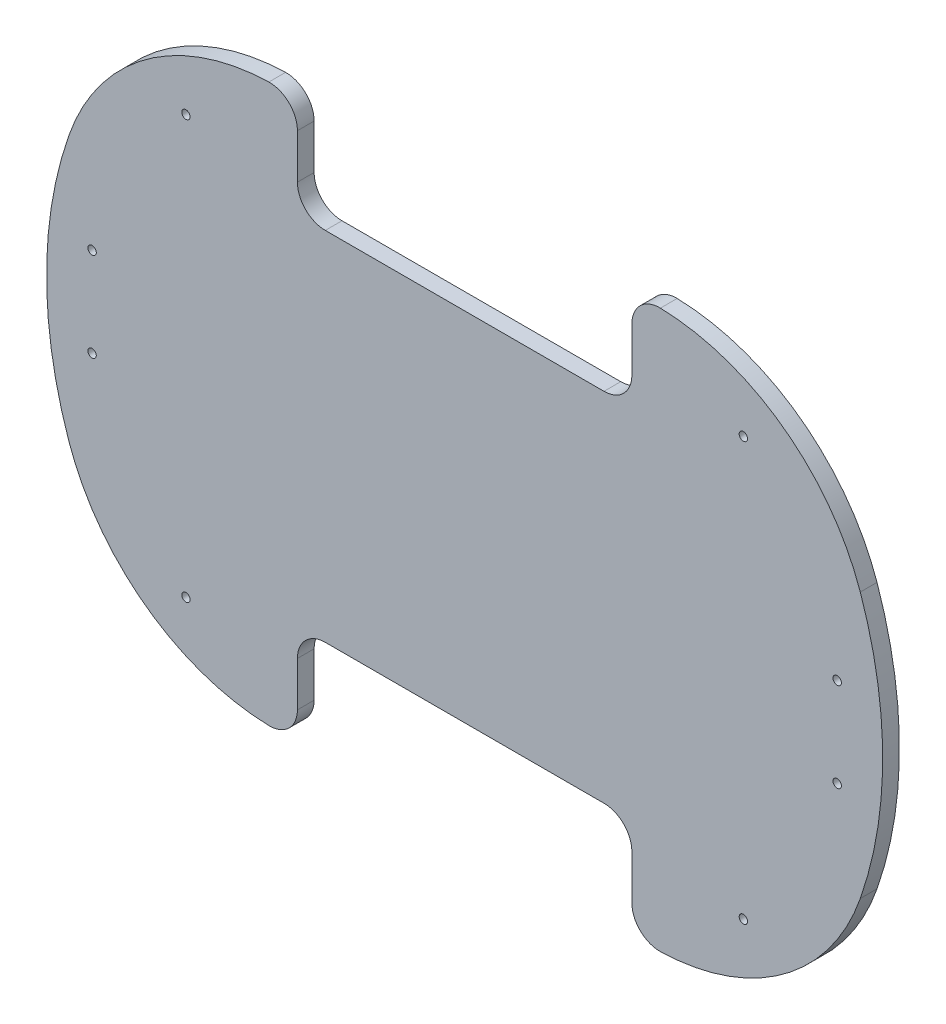
from build123d import *

# Parameters (mm, degrees)
BOSS_EXTRUDE1_DEPTH = 3
FILLET1_R           = 39
FILLET3_R           = 5
SKETCH7_R           = 0.75
CUT_EXTRUDE2_DEPTH  = 3
SKETCH8_R           = 0.75
CUT_EXTRUDE3_DEPTH  = 91.182696374


with BuildPart() as part:
    # Sketch1 → Boss-Extrude1 (new body)
    with BuildSketch(Plane.XY):
        Polygon((-30, 50), (-55, 50), (-55, -50), (-30, -50), (-30, -32), (30, -32), (30, -50), (55, -50), (55, 50), (30, 50), (30, 32), (-30, 32), align=None)
        with BuildLine():
            Line((-55, -50), (-55, 50))
            ThreePointArc((-55, 50), (-75, 0), (-55, -50))
        make_face()
        with BuildLine():
            ThreePointArc((55, -50), (75, 0), (55, 50))
            Line((55, 50), (55, -50))
        make_face()
    extrude(amount=BOSS_EXTRUDE1_DEPTH)

    # Fillet1
    fillet1_edges = [part.edges().sort_by_distance(p)[0] for p in [
        (-55, 50, 1.5),
        (55, 50, 1.5),
        (55, -50, 1.5),
        (-55, -50, 1.5),
    ]]
    fillet(fillet1_edges, radius=FILLET1_R)

    # Fillet3
    fillet3_edges = [part.edges().sort_by_distance(p)[0] for p in [
        (30, -50, 1.5),
        (-30, -50, 1.5),
        (30, 50, 1.5),
        (-30, 50, 1.5),
        (30, 32, 1.5),
        (-30, 32, 1.5),
        (-30, -32, 1.5),
        (30, -32, 1.5),
    ]]
    fillet(fillet3_edges, radius=FILLET3_R)

    # Sketch7 → Cut-Extrude2 (cut)
    with BuildSketch(Plane.XY.offset(3)):
        with Locations((-50, 37.5)):
            Circle(SKETCH7_R)
        with Locations((-50, -37.5)):
            Circle(SKETCH7_R)
        with Locations((50, -37.5)):
            Circle(SKETCH7_R)
        with Locations((50, 37.5)):
            Circle(SKETCH7_R)
    extrude(amount=-CUT_EXTRUDE2_DEPTH, mode=Mode.SUBTRACT)

    # Sketch8 → Cut-Extrude3 (cut, through all)
    with BuildSketch(Plane.XY.offset(3)):
        with Locations((-66.83099976, 8)):
            Circle(SKETCH8_R)
        with Locations((-66.83099976, -8)):
            Circle(SKETCH8_R)
        with Locations(Location((66.83099976, -8, 0), (0, 0, 180))):
            Circle(SKETCH8_R)
        with Locations(Location((66.83099976, 8, 0), (0, 0, 180))):
            Circle(SKETCH8_R)
    extrude(amount=-CUT_EXTRUDE3_DEPTH, mode=Mode.SUBTRACT)


solid = part.part
